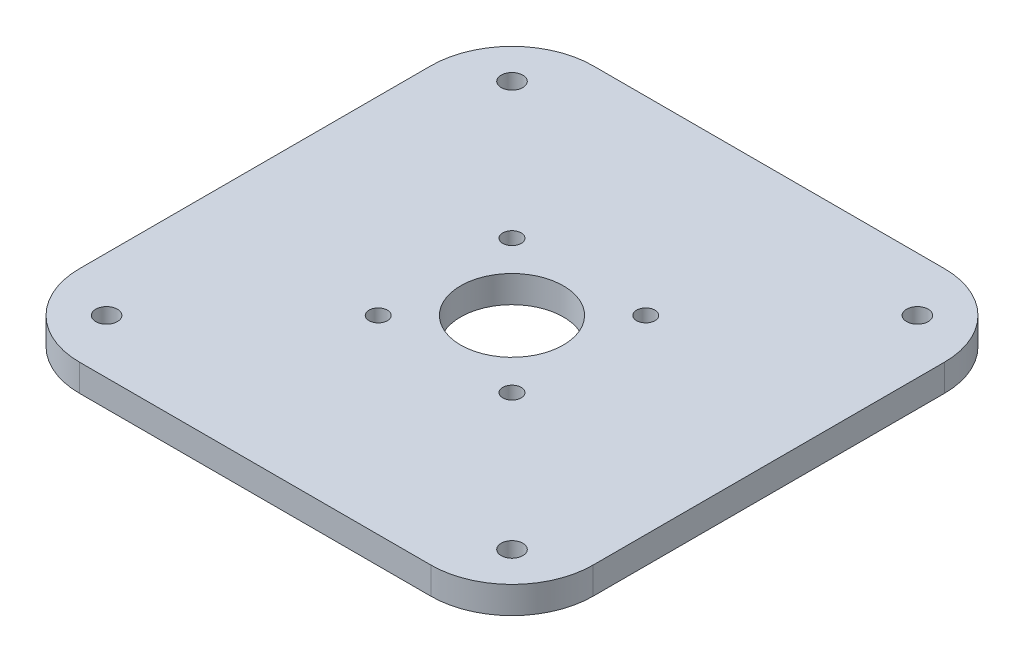
from build123d import *

# Parameters (mm, degrees)
SKETCH2_W             = 190
SKETCH2_H             = 190
EXTRUDE1_DEPTH        = 10
SKETCH3_R             = 19
SKETCH3_R_2           = 4
EXTRUDE2_DEPTH        = 10
FILLET1_R             = 30
M8_TAPPED_HOLE1_D     = 6.8
M8_TAPPED_HOLE1_DEPTH = 19.75
M8_TAPPED_HOLE1_TIP   = 2.042926105


with BuildPart() as part:
    # Sketch2 → Extrude1 (new body)
    with BuildSketch(Plane(origin=(0, 0, 0), x_dir=(1, 0, 0), z_dir=(0, 1, 0))):
        Rectangle(SKETCH2_W, SKETCH2_H)
    extrude(amount=EXTRUDE1_DEPTH)

    # Sketch3 → Extrude2 (cut)
    with BuildSketch(Plane(origin=(0, 10, 0), x_dir=(1, 0, 0), z_dir=(0, 1, 0))):
        with Locations(Location((0, 0, 0), (0, 0, 270))):
            Circle(SKETCH3_R)
        with Locations(Location((-75, 75, 0), (0, 0, 270))):
            Circle(SKETCH3_R_2)
        with Locations(Location((75, 75, 0), (0, 0, 90))):
            Circle(SKETCH3_R_2)
        with Locations(Location((75, -75, 0), (0, 0, 270))):
            Circle(SKETCH3_R_2)
        with Locations(Location((-75, -75, 0), (0, 0, 90))):
            Circle(SKETCH3_R_2)
    extrude(amount=-EXTRUDE2_DEPTH, mode=Mode.SUBTRACT)

    # Fillet1
    fillet1_edges = [part.edges().sort_by_distance(p)[0] for p in [
        (-95, 5, -95),
        (95, 5, -95),
        (95, 5, 95),
        (-95, 5, 95),
    ]]
    fillet(fillet1_edges, radius=FILLET1_R)

    # M8 Tapped Hole1
    with Locations(Plane(origin=(-24.748737342, 10, -24.748737342), x_dir=(0, 0, 1), z_dir=(0, 1, 0))):
        with Locations((0, 0), (0, 49.497474684), (49.497474684, 0), (49.497474684, 49.497474684)):
            Hole(M8_TAPPED_HOLE1_D / 2, depth=M8_TAPPED_HOLE1_DEPTH)
            with Locations((0, 0, -(M8_TAPPED_HOLE1_DEPTH + M8_TAPPED_HOLE1_TIP / 2))):  # 118° drill point
                Cone(0, M8_TAPPED_HOLE1_D / 2, M8_TAPPED_HOLE1_TIP, mode=Mode.SUBTRACT)


solid = part.part
